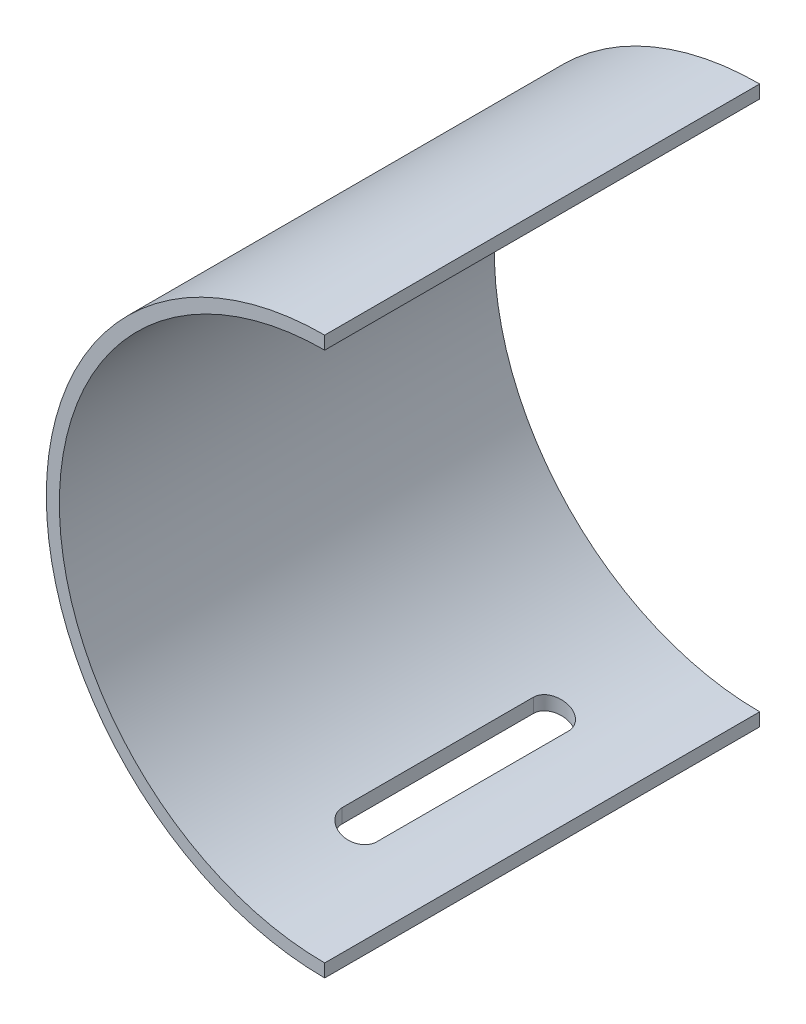
from build123d import *

# Parameters (mm, degrees)
SALIENTE_EXTRUIR1_DEPTH = 25
CORTAR_EXTRUIR1_DEPTH   = 25


with BuildPart() as part:
    # Croquis1 → Saliente-Extruir1 (new body)
    with BuildSketch(Plane.XY):
        with BuildLine():
            Line((0, 16), (0, 15.25))
            ThreePointArc((0, 15.25), (-15.25, 0), (0, -15.25))
            Line((0, -15.25), (0, -16))
            ThreePointArc((0, -16), (-16, 0), (0, 16))
        make_face()
    extrude(amount=SALIENTE_EXTRUIR1_DEPTH)

    # Croquis2 → Cortar-Extruir1 (cut)
    with BuildSketch(Plane(origin=(0, 0, 0), x_dir=(1, 0, 0), z_dir=(0, 1, 0))):
        with BuildLine():
            Line((-4, -7), (-4, -18))
            ThreePointArc((-4, -18), (-5, -19), (-6, -18))
            Line((-6, -18), (-6, -7))
            ThreePointArc((-6, -7), (-5, -6), (-4, -7))
        make_face()
    extrude(amount=-CORTAR_EXTRUIR1_DEPTH, mode=Mode.SUBTRACT)


solid = part.part
